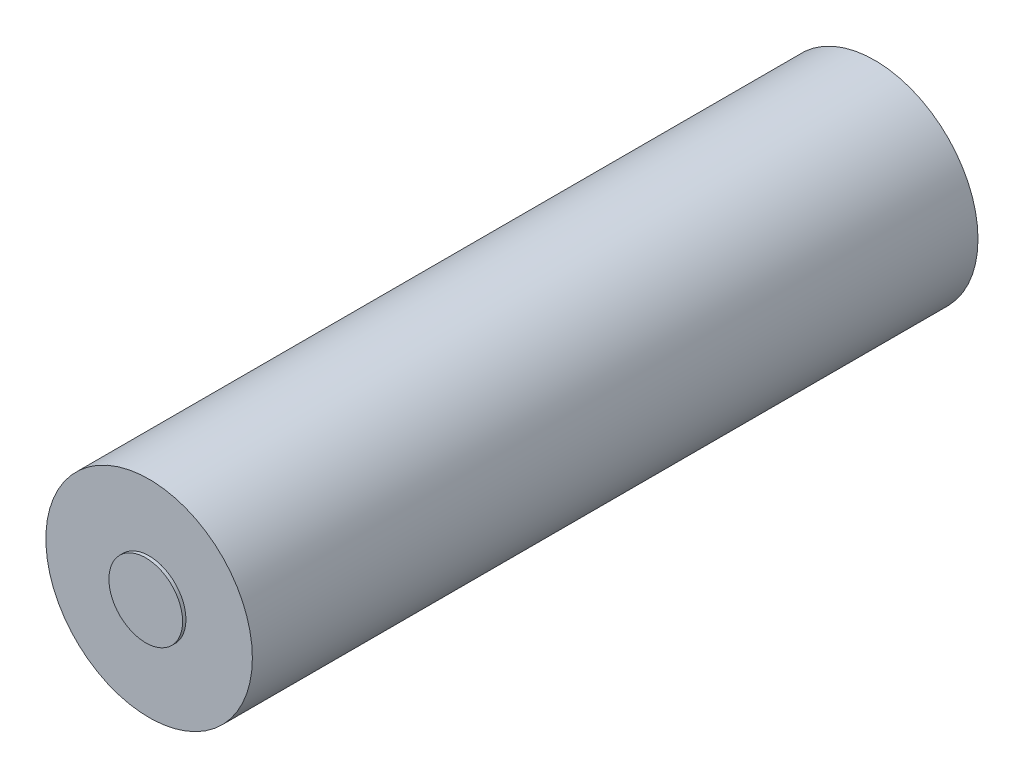
from build123d import *

# Parameters (mm, degrees)
SKETCH1_R           = 9.25
BOSS_EXTRUDE1_DEPTH = 65
SKETCH2_R           = 3.3
BOSS_EXTRUDE2_DEPTH = 0.3


with BuildPart() as part:
    # Sketch1 → Boss-Extrude1 (new body)
    with BuildSketch(Plane.XY):
        Circle(SKETCH1_R)
    extrude(amount=BOSS_EXTRUDE1_DEPTH)

    # Sketch2 → Boss-Extrude2 (add)
    with BuildSketch(Plane.XY.offset(65)):
        Circle(SKETCH2_R)
    extrude(amount=BOSS_EXTRUDE2_DEPTH)


solid = part.part
